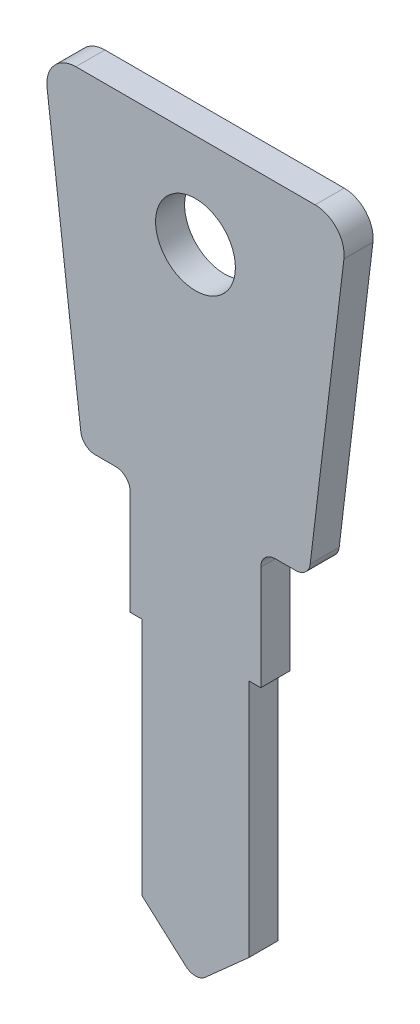
from build123d import *

# Parameters (mm, degrees)
EXTRUDE_1_DEPTH      = 1
EXTRUDE_1_DEPTH_BACK = 1
FILLET_1_R           = 1
SKETCH_2_R           = 2.75
CUT_EXTRUDE_1_DEPTH  = 2
SKETCH_3_W           = 8.5
SKETCH_3_H           = 3.25
CUT_EXTRUDE_2_DEPTH  = 0.3
EXTRUDE_2_DEPTH      = 0.3


with BuildPart() as part:
    # 草图1 → 凸台-拉伸1 (new, two sides: drawn at the far end of the back side and taken through both)
    with BuildSketch(Plane.XY.offset(-EXTRUDE_1_DEPTH_BACK)):
        with BuildLine():
            Line((-7.905702574, 0.880854779), (-10.231405147, 20.261709559))
            ThreePointArc((-10.231405147, 20.261709559), (-9.741743192, 21.827294074), (-8.24565147, 22.5))
            Line((-8.24565147, 22.5), (8.24565147, 22.5))
            ThreePointArc((8.24565147, 22.5), (9.741743192, 21.827294074), (10.231405147, 20.261709559))
            Line((10.231405147, 20.261709559), (7.905702574, 0.880854779))
            ThreePointArc((7.905702574, 0.880854779), (7.576472772, 0.251954139), (6.912825735, 0))
            Line((6.912825735, 0), (5.5, 0))
            ThreePointArc((5.5, 0), (4.792893219, -0.292893219), (4.5, -1))
            Line((4.5, -1), (4.5, -8.2))
            Line((4.5, -8.2), (3.7, -8.2))
            Line((3.7, -8.2), (3.7, -24.7))
            Line((3.7, -24.7), (0, -28))
            Line((0, -28), (-3.7, -24.7))
            Line((-3.7, -24.7), (-3.7, -8.2))
            Line((-3.7, -8.2), (-4.5, -8.2))
            Line((-4.5, -8.2), (-4.5, -1))
            ThreePointArc((-4.5, -1), (-4.792893219, -0.292893219), (-5.5, 0))
            Line((-5.5, 0), (-6.912825735, 0))
            ThreePointArc((-6.912825735, 0), (-7.576472772, 0.251954139), (-7.905702574, 0.880854779))
        make_face()
    extrude(amount=EXTRUDE_1_DEPTH + EXTRUDE_1_DEPTH_BACK)

    # 圆角1
    fillet_1_edges = [part.edges().sort_by_distance(p)[0] for p in [
        (0, -28, 0),
    ]]
    fillet(fillet_1_edges, radius=FILLET_1_R)

    # 草图2 → 切除-拉伸1 (cut)
    with BuildSketch(Plane.XY.offset(1)):
        with Locations((0, 16)):
            Circle(SKETCH_2_R)
    extrude(amount=-CUT_EXTRUDE_1_DEPTH, mode=Mode.SUBTRACT)

    # 草图3 → 切除-拉伸2 (cut)
    with BuildSketch(Plane(origin=(0, 0, -1), x_dir=(-1, 0, 0), z_dir=(0, 0, -1))):
        with Locations((0, 4.625)):
            Rectangle(SKETCH_3_W, SKETCH_3_H)
    extrude(amount=-CUT_EXTRUDE_2_DEPTH, mode=Mode.SUBTRACT)

    # 草图4 → 凸台-拉伸2 (add)
    # profile 1 of 4: a face of its own
    with BuildSketch(Plane(origin=(0, 0, -0.7), x_dir=(-1, 0, 0), z_dir=(0, 0, -1))):
        with BuildLine():
            add(Edge.make_bspline(
                [(0.399122807, 4.780376868), (0.400793442, 4.818081272), (0.404051869, 4.891620419), (0.41346614, 4.998848791), (0.424834831, 5.10033141), (0.439615632, 5.195757922), (0.457883956, 5.284810697), (0.478561454, 5.367956448), (0.502457562, 5.444962532), (0.537644076, 5.539009508), (0.590407934, 5.64725644), (0.66588086, 5.766227573), (0.753582907, 5.873174256), (0.836551833, 5.951537589), (0.908491505, 6.006690069), (0.965969932, 6.042498788), (1.026356453, 6.073094643), (1.0898491, 6.098046205), (1.156331115, 6.116632715), (1.225626369, 6.13035494), (1.297963562, 6.138843717), (1.372503478, 6.141369233), (1.447605064, 6.137833051), (1.521381618, 6.126313165), (1.592574704, 6.105862424), (1.661232935, 6.077786785), (1.727169458, 6.04171307), (1.790716184, 5.997931041), (1.851119746, 5.945308439), (1.909132977, 5.885981999), (1.963319033, 5.820688529), (2.012953339, 5.750688148), (2.057829715, 5.676702898), (2.097349996, 5.598326893), (2.132775235, 5.51625124), (2.16249386, 5.429744869), (2.187080898, 5.339159228), (2.214155076, 5.211191119), (2.237974484, 5.041444736), (2.254755557, 4.826610717), (2.258584741, 4.597537479), (2.25288302, 4.399436027), (2.242135144, 4.238928151), (2.229915997, 4.122509789), (2.213503564, 4.012024178), (2.194397538, 3.906933522), (2.170494744, 3.807796696), (2.142169677, 3.714507478), (2.111565713, 3.626456436), (2.075543194, 3.544569122), (2.036309018, 3.468150108), (1.991578703, 3.398178286), (1.943119651, 3.333708529), (1.889647275, 3.275251734), (1.830464905, 3.223985456), (1.767631588, 3.177435906), (1.699459885, 3.137816996), (1.627766384, 3.104196493), (1.553927475, 3.077438856), (1.478865, 3.059999021), (1.403994972, 3.049633484), (1.328789791, 3.049595563), (1.253695034, 3.056134309), (1.179019096, 3.073334851), (1.10384087, 3.096983734), (1.030174034, 3.130427734), (0.959271444, 3.16893682), (0.892533203, 3.210384167), (0.83178318, 3.255484825), (0.776535975, 3.303648611), (0.726102395, 3.354471138), (0.681077633, 3.408434877), (0.641929023, 3.465689254), (0.598181163, 3.546267172), (0.551313233, 3.650202925), (0.502805186, 3.778226808), (0.463159392, 3.909330144), (0.437666339, 4.021994032), (0.420858805, 4.116245991), (0.41161127, 4.193509134), (0.403578394, 4.27667987), (0.398723555, 4.365777577), (0.395494269, 4.460879503), (0.39408883, 4.562053397), (0.395593107, 4.669287487), (0.397925468, 4.742693318), (0.399122807, 4.780376868)],
                knots=[0, 0, 0, 0, 1.18043416, 2.302333746, 3.366253517, 4.374302266, 5.321670991, 6.208995316, 7.053297808, 7.84229274, 9.348259463, 10.810477328, 12.240076564, 13.663562249, 14.3695339, 15.072606272, 15.778577923, 16.484387009, 17.202829605, 17.934942377, 18.692112664, 19.478485278, 20.265441384, 21.040673806, 21.808439453, 22.577161074, 23.356320991, 24.155029842, 24.986154494, 25.858111265, 26.748121484, 27.637306138, 28.540117759, 29.452135788, 30.380885827, 31.334339875, 32.310628684, 33.31521083, 35.42407972, 37.666773946, 40.052062172, 42.587025658, 43.863776122, 45.083322308, 46.247467896, 47.357025429, 48.423487632, 49.435172604, 50.405897663, 51.337337341, 52.231284254, 53.090220275, 53.931690991, 54.751583713, 55.562922169, 56.377338113, 57.194202079, 58.024663732, 58.851830165, 59.645552351, 60.431282623, 61.21044254, 61.99312915, 62.783838437, 63.60230231, 64.454612977, 65.309477934, 66.125301685, 66.909862715, 67.67340185, 68.415973016, 69.147238889, 69.868837108, 70.581506411, 72.0124375, 73.431838244, 74.861437481, 76.292961888, 77.042577341, 77.855187732, 78.726196438, 79.655959089, 80.645695907, 81.702690171, 82.820655125, 84, 84, 84, 84], degree=3))
        make_face()
        with BuildLine():
            add(Edge.make_bspline(
                [(0.76754386, 4.885640026), (0.763560845, 4.846029288), (0.755714168, 4.767994757), (0.749296536, 4.652232055), (0.747467685, 4.539746345), (0.749142415, 4.430492145), (0.755600971, 4.324683218), (0.76662036, 4.222114803), (0.782317153, 4.122858893), (0.801528639, 4.027178703), (0.824546647, 3.936603496), (0.851844157, 3.852363871), (0.882915295, 3.775073496), (0.917287274, 3.704615945), (0.955017202, 3.640907106), (0.996807652, 3.584308752), (1.041486151, 3.533616843), (1.090387927, 3.491016293), (1.140543814, 3.455241027), (1.19182262, 3.42744398), (1.243388022, 3.407746977), (1.295436833, 3.395703378), (1.347781448, 3.391857933), (1.400442737, 3.395582803), (1.453031162, 3.408583582), (1.50528551, 3.428509099), (1.555706584, 3.455952808), (1.603406684, 3.489091224), (1.647391248, 3.528665588), (1.687683532, 3.574251112), (1.724053136, 3.626129773), (1.757330672, 3.683414655), (1.786550877, 3.747055911), (1.820911323, 3.840238056), (1.855515573, 3.964331708), (1.886302034, 4.119397323), (1.904460644, 4.281110549), (1.909221641, 4.447028271), (1.906126044, 4.611888034), (1.902413266, 4.771591516), (1.893485755, 4.923440249), (1.882801297, 5.068207456), (1.864668773, 5.206539481), (1.831252948, 5.33771178), (1.784447186, 5.462080038), (1.736406144, 5.560256114), (1.690364961, 5.631520889), (1.654069616, 5.679337504), (1.613718453, 5.719294018), (1.571170492, 5.753357184), (1.525435969, 5.779290179), (1.476928483, 5.798688673), (1.425669218, 5.810710075), (1.37243499, 5.816637598), (1.318803331, 5.815601387), (1.266124095, 5.806188025), (1.215030571, 5.789725361), (1.165201269, 5.766288757), (1.117681655, 5.734567957), (1.071712153, 5.695744658), (1.027810645, 5.64916511), (0.984564834, 5.596093486), (0.945117128, 5.534466978), (0.90863497, 5.465433707), (0.876282087, 5.388106702), (0.847306734, 5.30293351), (0.821284074, 5.209918753), (0.799404252, 5.109006475), (0.781247866, 5.000116245), (0.772215986, 4.924668568), (0.76754386, 4.885640026)],
                knots=[0, 0, 0, 0, 1.378198314, 2.715098627, 4.012594964, 5.272602849, 6.497213731, 7.681415101, 8.842769074, 9.975170128, 11.059162755, 12.076494648, 13.038717388, 13.940857576, 14.788360499, 15.598271168, 16.373595835, 17.122768248, 17.838466736, 18.502782022, 19.136468245, 19.744060339, 20.345653328, 20.947246317, 21.563841626, 22.214212994, 22.87852828, 23.546305104, 24.220743313, 24.921956094, 25.648106704, 26.41081768, 27.212668989, 28.069279432, 29.84713992, 31.666334073, 33.537864714, 35.473745168, 37.408579624, 39.246547954, 41.003985019, 42.674193204, 44.272363647, 45.827394737, 47.348405091, 48.867584295, 49.599750274, 50.283750763, 50.94125936, 51.560811542, 52.165388272, 52.754418158, 53.363720025, 53.982318455, 54.604903792, 55.213928724, 55.828148287, 56.458765578, 57.113918044, 57.800421407, 58.537638978, 59.326979919, 60.167286366, 61.066273245, 62.027297208, 63.065989643, 64.179487018, 65.369443928, 66.639232213, 68, 68, 68, 68], degree=3))
        make_face(mode=Mode.SUBTRACT)
    # profile 2 of 4: a face of its own
    with BuildSketch(Plane(origin=(0, 0, -0.7), x_dir=(-1, 0, 0), z_dir=(0, 0, -1))):
        with BuildLine():
            add(Edge.make_bspline(
                [(-4.039473684, 3.175438596), (-4.037351439, 3.197169661), (-4.033133369, 3.240361253), (-4.018321974, 3.30390172), (-3.997481253, 3.365939742), (-3.970062914, 3.426447504), (-3.936208296, 3.48544953), (-3.894566277, 3.54169662), (-3.848065617, 3.597667849), (-3.792454864, 3.650570353), (-3.732494119, 3.706858692), (-3.67038768, 3.7712877), (-3.603117786, 3.841628566), (-3.533410138, 3.920878964), (-3.458321509, 4.006189001), (-3.380740218, 4.100079285), (-3.298813309, 4.200754063), (-3.214839889, 4.30634151), (-3.132548828, 4.41239114), (-3.056715341, 4.515169045), (-2.987750911, 4.6111352), (-2.926212091, 4.700628405), (-2.873738654, 4.784679644), (-2.828170527, 4.861984598), (-2.789288826, 4.932403479), (-2.750488664, 5.016507062), (-2.713869046, 5.11350061), (-2.685155328, 5.223688116), (-2.672107383, 5.325665159), (-2.677236837, 5.419375231), (-2.697379741, 5.504892295), (-2.73257286, 5.582476266), (-2.78196109, 5.652402722), (-2.845103987, 5.71205751), (-2.917079241, 5.761171146), (-2.997175041, 5.794170322), (-3.08287679, 5.810847301), (-3.172536655, 5.809338476), (-3.262910482, 5.793271123), (-3.352942124, 5.765343193), (-3.439733527, 5.722100231), (-3.524761164, 5.668153018), (-3.60354006, 5.598652702), (-3.672782382, 5.513065917), (-3.731685647, 5.411828659), (-3.761072633, 5.33703922), (-3.776315789, 5.298245614)],
                knots=[0, 0, 0, 0, 0.683264685, 1.358023177, 2.0380809, 2.730345762, 3.435487858, 4.164189287, 4.919895072, 5.711413948, 6.565494804, 7.49616148, 8.513531843, 9.613812574, 10.80147361, 12.073102873, 13.428218159, 14.866997124, 16.298560904, 17.632315587, 18.867297526, 20.000038836, 21.033387935, 21.969994494, 22.810824564, 23.551397478, 24.869445784, 26.052467085, 27.111050094, 28.075902372, 28.975949733, 29.847314516, 30.728213316, 31.639844513, 32.554273251, 33.442456201, 34.333871785, 35.270085163, 36.233696473, 37.201335111, 38.211692251, 39.261697588, 40.347896805, 41.485826765, 42.695887429, 44, 44, 44, 44], degree=3))
            Line((-3.776315789, 5.298245614), (-4.109649123, 5.350877193))
            add(Edge.make_bspline(
                [(-4.109649123, 5.350877193), (-4.097880422, 5.38350706), (-4.074983644, 5.446990607), (-4.035556194, 5.537388103), (-3.99482671, 5.62153642), (-3.951677246, 5.698878003), (-3.905171697, 5.768860789), (-3.856438039, 5.832165149), (-3.805259124, 5.8887826), (-3.751438193, 5.938646919), (-3.695160073, 5.982604739), (-3.636038287, 6.020726375), (-3.574808993, 6.054026645), (-3.511231337, 6.082288097), (-3.44516803, 6.105064049), (-3.376325334, 6.12162702), (-3.30540738, 6.134476571), (-3.256981356, 6.138376015), (-3.23245614, 6.140350877)],
                knots=[0, 0, 0, 0, 1.318688324, 2.565594597, 3.747971738, 4.872722892, 5.930337296, 6.940181326, 7.908044283, 8.828858542, 9.726735078, 10.619953387, 11.500744836, 12.374616489, 13.262770363, 14.15366946, 15.064931369, 16, 16, 16, 16], degree=3))
            add(Edge.make_bspline(
                [(-3.23245614, 6.140350877), (-3.203886447, 6.142642272), (-3.148323922, 6.14709859), (-3.066886278, 6.147937647), (-2.990031483, 6.142622292), (-2.916399696, 6.132527469), (-2.844465268, 6.114682162), (-2.772375129, 6.088350082), (-2.699447521, 6.052759354), (-2.625801048, 6.00910691), (-2.553610242, 5.955670053), (-2.488252708, 5.888476105), (-2.430577386, 5.808826007), (-2.379045944, 5.718722394), (-2.337451731, 5.61741873), (-2.312436978, 5.504581741), (-2.303264087, 5.382180424), (-2.308304334, 5.274214278), (-2.320582057, 5.18285455), (-2.337784489, 5.109838179), (-2.3625761, 5.033827987), (-2.391765486, 4.953646687), (-2.430525813, 4.871195716), (-2.474153356, 4.784705201), (-2.526325001, 4.695743204), (-2.573670388, 4.618884454), (-2.616565826, 4.554890807), (-2.652494502, 4.502671536), (-2.691744574, 4.446929886), (-2.735799519, 4.388552135), (-2.782327115, 4.32619976), (-2.832375659, 4.260411378), (-2.886380783, 4.191757348), (-2.943717795, 4.119367531), (-3.00464559, 4.043434976), (-3.069439154, 3.964399718), (-3.138080589, 3.882439496), (-3.209501743, 3.796443673), (-3.28457229, 3.70713304), (-3.363349721, 3.614591748), (-3.446094206, 3.519236801), (-3.502131202, 3.454207782), (-3.530701754, 3.421052632)],
                knots=[0, 0, 0, 0, 0.924262298, 1.797511285, 2.623724224, 3.407158757, 4.191620419, 5.009283641, 5.877881841, 6.805175164, 7.767818098, 8.765683208, 9.814991193, 10.931884262, 12.107176208, 13.332417047, 14.642951659, 16.055476784, 16.810263112, 17.613474593, 18.470705512, 19.388078144, 20.363412498, 21.406914204, 22.511682051, 23.688322701, 24.318011351, 24.996206783, 25.732766533, 26.516574724, 27.354866926, 28.242087009, 29.182574856, 30.172115786, 31.220563025, 32.322544456, 33.468316952, 34.668650042, 35.928027342, 37.231299145, 38.588373428, 40, 40, 40, 40], degree=3))
            Line((-3.530701754, 3.421052632), (-2.26754386, 3.421052632))
            Line((-2.26754386, 3.421052632), (-2.26754386, 3.105263158))
            Line((-2.26754386, 3.105263158), (-4.039473684, 3.105263158))
            Line((-4.039473684, 3.105263158), (-4.039473684, 3.175438596))
        make_face()
    # profile 3 of 4: a face of its own
    with BuildSketch(Plane(origin=(0, 0, -0.7), x_dir=(-1, 0, 0), z_dir=(0, 0, -1))):
        with BuildLine():
            add(Edge.make_bspline(
                [(-1.881578947, 3.964912281), (-1.880383807, 3.999884325), (-1.877981189, 4.070189429), (-1.856607791, 4.174371348), (-1.824027936, 4.277623238), (-1.785796752, 4.361397686), (-1.74850546, 4.426849053), (-1.715105133, 4.473583869), (-1.677737135, 4.518104744), (-1.636381974, 4.560462755), (-1.589604809, 4.599451343), (-1.539057387, 4.63637158), (-1.48428014, 4.671183874), (-1.445310799, 4.691429989), (-1.425438596, 4.701754386)],
                knots=[0, 0, 0, 0, 1.374126598, 2.76243824, 4.166032791, 5.626085304, 6.374165685, 7.125778304, 7.881627021, 8.658683375, 9.450540369, 10.273494042, 11.119577685, 12, 12, 12, 12], degree=3))
            add(Edge.make_bspline(
                [(-1.425438596, 4.701754386), (-1.458006702, 4.722017303), (-1.519842426, 4.760489671), (-1.599996669, 4.826764968), (-1.662659869, 4.896962319), (-1.70811556, 4.971774383), (-1.738977877, 5.051226581), (-1.762278086, 5.134667553), (-1.778571393, 5.223388287), (-1.786698013, 5.315381075), (-1.787113285, 5.406989917), (-1.778141981, 5.494129314), (-1.760774686, 5.574894852), (-1.734399567, 5.64949599), (-1.699187945, 5.71946179), (-1.655764701, 5.786001444), (-1.606515159, 5.851765522), (-1.54912565, 5.912988598), (-1.487200412, 5.969360344), (-1.420636955, 6.016653523), (-1.350432312, 6.053516497), (-1.276485736, 6.08002635), (-1.199738586, 6.099205825), (-1.119774506, 6.112786513), (-1.036856142, 6.121362929), (-0.951756144, 6.123447615), (-0.867385818, 6.121735849), (-0.785996282, 6.115358417), (-0.709167134, 6.104313636), (-0.635246361, 6.088868336), (-0.562499618, 6.065544544), (-0.488261026, 6.033711708), (-0.413366818, 5.989555216), (-0.335753487, 5.93932166), (-0.262100197, 5.877153235), (-0.199025908, 5.800868208), (-0.146693243, 5.712894786), (-0.113462194, 5.630749915), (-0.094025235, 5.5599339), (-0.082571192, 5.503991496), (-0.077100159, 5.445660689), (-0.075509783, 5.385252623), (-0.080086134, 5.322567752), (-0.087385947, 5.257563476), (-0.100895716, 5.190611602), (-0.117998001, 5.122254893), (-0.140466865, 5.054030426), (-0.172833732, 4.989381668), (-0.212952348, 4.928507142), (-0.260357985, 4.871081114), (-0.316554247, 4.818124274), (-0.380177883, 4.768748901), (-0.452307963, 4.723813491), (-0.504060094, 4.697669357), (-0.530701754, 4.684210526)],
                knots=[0, 0, 0, 0, 1.410033332, 2.677172402, 3.812064432, 4.856127883, 5.878591605, 6.938109193, 8.03995885, 9.192064022, 10.3315345, 11.405101817, 12.408541443, 13.363710648, 14.308049618, 15.282826904, 16.283668828, 17.326789228, 18.365059226, 19.359919842, 20.322241493, 21.272612498, 22.242786748, 23.229219042, 24.254411489, 25.306713209, 26.358803724, 27.358026599, 28.307996659, 29.212919167, 30.132734509, 31.114165642, 32.177631088, 33.326839266, 34.513504529, 35.70718515, 36.950754538, 38.266204093, 38.952498493, 39.651034787, 40.363832527, 41.105058096, 41.871509902, 42.674059092, 43.510125888, 44.381738271, 45.266222349, 46.146424753, 47.03266586, 47.943741995, 48.879333301, 49.867534116, 50.90222043, 52, 52, 52, 52], degree=3))
            add(Edge.make_bspline(
                [(-0.530701754, 4.684210526), (-0.506538212, 4.67676723), (-0.459610952, 4.662311837), (-0.393299128, 4.635435297), (-0.332272925, 4.605997391), (-0.276347869, 4.574143457), (-0.2267313, 4.537612413), (-0.181485115, 4.499674614), (-0.142132328, 4.457855489), (-0.09820916, 4.397512067), (-0.052545161, 4.315687936), (-0.013925053, 4.207452367), (0.008326583, 4.089339348), (0.015329158, 3.96558331), (0.009619807, 3.844120218), (-0.003296972, 3.731494511), (-0.028638412, 3.631978864), (-0.06351143, 3.545164969), (-0.105238911, 3.469258029), (-0.147552524, 3.399769805), (-0.192646858, 3.336926099), (-0.240439752, 3.280001858), (-0.293738771, 3.228695272), (-0.355844789, 3.184307458), (-0.426603833, 3.145404333), (-0.506050857, 3.111437631), (-0.595755002, 3.084535554), (-0.69602882, 3.066507246), (-0.80721287, 3.054777793), (-0.925981956, 3.051487409), (-1.045817327, 3.054878765), (-1.160012964, 3.066617444), (-1.265780914, 3.08498162), (-1.363056702, 3.111634724), (-1.452390504, 3.145627352), (-1.532598314, 3.189667989), (-1.607053613, 3.238296611), (-1.671910532, 3.296795913), (-1.728626462, 3.360960048), (-1.776026449, 3.430885935), (-1.812604436, 3.506777208), (-1.840067651, 3.58803268), (-1.85794592, 3.675061848), (-1.87162949, 3.766816618), (-1.880366584, 3.86403006), (-1.881167463, 3.930672173), (-1.881578947, 3.964912281)],
                knots=[0, 0, 0, 0, 0.834664037, 1.620974963, 2.359958192, 3.071500661, 3.742523023, 4.391885647, 5.019370884, 5.633088925, 6.853041206, 8.099687998, 9.411290177, 10.808708308, 12.183221387, 13.42351142, 14.545940998, 15.563362997, 16.504155904, 17.403380615, 18.249005911, 19.055869055, 19.855247075, 20.685085447, 21.568786071, 22.517377533, 23.533390568, 24.654269325, 25.877028168, 27.222423441, 28.574967808, 29.833297063, 31.01045681, 32.11582339, 33.159850443, 34.158288642, 35.132345709, 36.089875077, 37.032569401, 37.955047952, 38.86995275, 39.806385064, 40.780048122, 41.799705361, 42.869508764, 44, 44, 44, 44], degree=3))
        make_face()
        with BuildLine():
            add(Edge.make_bspline(
                [(-1.522254711, 3.98245614), (-1.522657305, 3.948416695), (-1.523439954, 3.88224341), (-1.510747442, 3.786199494), (-1.487896828, 3.696683563), (-1.460370304, 3.626836797), (-1.430800475, 3.57602558), (-1.404771885, 3.541441968), (-1.374636042, 3.510351595), (-1.339790015, 3.48406452), (-1.301576422, 3.459987616), (-1.258902625, 3.440284611), (-1.21209015, 3.423906174), (-1.144493224, 3.40679593), (-1.055568166, 3.394610051), (-0.946416573, 3.390207329), (-0.835220579, 3.399548226), (-0.742169607, 3.415097333), (-0.669644729, 3.435641986), (-0.618688869, 3.454865065), (-0.572213392, 3.479036616), (-0.530188103, 3.507715608), (-0.493080797, 3.541330498), (-0.459495041, 3.578442292), (-0.430691973, 3.620419362), (-0.399554211, 3.681784677), (-0.369051257, 3.761201384), (-0.346693525, 3.858803427), (-0.337711918, 3.95615765), (-0.343320558, 4.036937394), (-0.354912537, 4.100085307), (-0.369204175, 4.145737862), (-0.389153773, 4.189198514), (-0.413887044, 4.230863762), (-0.443988984, 4.270919444), (-0.480021182, 4.308271281), (-0.520498811, 4.344324771), (-0.58071782, 4.388793834), (-0.662011716, 4.435416356), (-0.766227141, 4.475221569), (-0.875616366, 4.493672855), (-0.986573998, 4.494002535), (-1.094661895, 4.478209282), (-1.195604919, 4.446601719), (-1.286097378, 4.397964347), (-1.353126534, 4.346134549), (-1.399737968, 4.297869823), (-1.43031179, 4.259157768), (-1.457565585, 4.219003692), (-1.47867658, 4.175616143), (-1.496431513, 4.130469689), (-1.510292652, 4.083153996), (-1.518531889, 4.033388199), (-1.521002159, 3.999592353), (-1.522254711, 3.98245614)],
                knots=[0, 0, 0, 0, 1.45021583, 2.819245253, 4.116311686, 5.383839525, 6.004804309, 6.61809702, 7.225519428, 7.844420058, 8.474928218, 9.148418113, 9.843660174, 10.58739695, 12.118283095, 13.661739419, 15.236493707, 16.868915606, 17.675810439, 18.447690583, 19.187171155, 19.904516724, 20.610957382, 21.317398041, 22.03474361, 22.774224182, 24.247695365, 25.650274601, 27.031710525, 28.40179887, 29.088335786, 29.76605575, 30.435671148, 31.123139383, 31.828794671, 32.567062931, 33.332561727, 34.137975047, 35.755592712, 37.313353339, 38.869799076, 40.458468512, 42.027252455, 43.511108451, 44.944907386, 46.386035674, 47.104569492, 47.801282449, 48.487819365, 49.169367754, 49.853726664, 50.555320331, 51.267473945, 52, 52, 52, 52], degree=3))
        make_face(mode=Mode.SUBTRACT)
        with BuildLine():
            add(Edge.make_bspline(
                [(-1.460526316, 5.350877193), (-1.458970032, 5.321925542), (-1.455844776, 5.263786175), (-1.431883686, 5.177958408), (-1.392857346, 5.094726886), (-1.348583681, 5.028819126), (-1.305620233, 4.979870438), (-1.26791168, 4.94767844), (-1.226142382, 4.920085862), (-1.179398199, 4.89811178), (-1.128683894, 4.880535388), (-1.073539597, 4.868172022), (-1.014099492, 4.861422296), (-0.951754135, 4.858727531), (-0.889195197, 4.861451048), (-0.829328494, 4.868180422), (-0.773525141, 4.880512687), (-0.722027511, 4.898259748), (-0.674137152, 4.920034677), (-0.631015849, 4.947839077), (-0.591480473, 4.9798096), (-0.556710057, 5.016830469), (-0.526399926, 5.057300763), (-0.499518169, 5.099484085), (-0.477145055, 5.144060449), (-0.459968242, 5.190575782), (-0.446497738, 5.238772902), (-0.438439229, 5.28890763), (-0.433692485, 5.34102174), (-0.433775929, 5.394297943), (-0.438274297, 5.44665735), (-0.446514563, 5.496549385), (-0.459377156, 5.542835531), (-0.477145692, 5.585541846), (-0.49911362, 5.624830544), (-0.526264791, 5.660000916), (-0.556754704, 5.692370635), (-0.592395484, 5.720100613), (-0.63108609, 5.745034328), (-0.673964437, 5.764902478), (-0.7194809, 5.782027527), (-0.768479195, 5.794907316), (-0.820649689, 5.803954842), (-0.876265537, 5.809062664), (-0.935103169, 5.81028256), (-0.995825895, 5.807461712), (-1.055789362, 5.802120278), (-1.112546184, 5.792489032), (-1.164644254, 5.77876335), (-1.212195768, 5.762144308), (-1.255136723, 5.741721534), (-1.293669228, 5.717979619), (-1.327091665, 5.689664617), (-1.364758427, 5.64810071), (-1.403444979, 5.590973818), (-1.43584876, 5.515677716), (-1.457281407, 5.435223911), (-1.459429361, 5.37939096), (-1.460526316, 5.350877193)],
                knots=[0, 0, 0, 0, 1.534693845, 3.081901317, 4.691243309, 6.396534232, 7.275531407, 8.139372323, 9.019120457, 9.923811509, 10.872401943, 11.862147786, 12.91556615, 14.042756034, 15.169945918, 16.234774491, 17.235732746, 18.195190674, 19.120665344, 20.019718268, 20.909987491, 21.812339702, 22.706457796, 23.589652117, 24.463374508, 25.347092071, 26.216951264, 27.114386788, 28.037289102, 28.991155695, 29.936957382, 30.823062971, 31.670776101, 32.479662527, 33.27221946, 34.051415611, 34.83171274, 35.625019215, 36.441220146, 37.268830285, 38.126995544, 39.019043232, 39.952404705, 40.933573035, 41.979631126, 43.072373492, 44.157596343, 45.172184403, 46.122722093, 47.013287973, 47.840898113, 48.641248973, 49.407885578, 50.156214404, 51.612891957, 53.043495678, 54.490119686, 56, 56, 56, 56], degree=3))
        make_face(mode=Mode.SUBTRACT)
    # profile 4 of 4: a face of its own
    with BuildSketch(Plane(origin=(0, 0, -0.7), x_dir=(-1, 0, 0), z_dir=(0, 0, -1))):
        with BuildLine():
            add(Edge.make_bspline(
                [(3.469298246, 5.526315789), (3.429356525, 5.487995446), (3.347044334, 5.4090246), (3.208593853, 5.299295504), (3.05599468, 5.190463998), (2.946634355, 5.122630529), (2.890350877, 5.087719298)],
                knots=[0, 0, 0, 0, 0.911926792, 1.879305458, 2.908561558, 4, 4, 4, 4], degree=3))
            Line((2.890350877, 5.087719298), (2.890350877, 5.421052632))
            add(Edge.make_bspline(
                [(2.890350877, 5.421052632), (2.926373374, 5.446007795), (2.997914756, 5.495569236), (3.099435879, 5.576180527), (3.197586819, 5.658260086), (3.289399522, 5.745160444), (3.377793644, 5.833919149), (3.459841324, 5.927023569), (3.537977755, 6.022686378), (3.585738357, 6.089405099), (3.609649123, 6.122807018)],
                knots=[0, 0, 0, 0, 1.040526584, 2.066506081, 3.077559129, 4.07840537, 5.067830316, 6.05167646, 7.024595449, 8, 8, 8, 8], degree=3))
            Line((3.609649123, 6.122807018), (3.820175439, 6.122807018))
            Line((3.820175439, 6.122807018), (3.820175439, 3.105263158))
            Line((3.820175439, 3.105263158), (3.469298246, 3.105263158))
            Line((3.469298246, 3.105263158), (3.469298246, 5.526315789))
        make_face()
    extrude(amount=EXTRUDE_2_DEPTH)


solid = part.part
